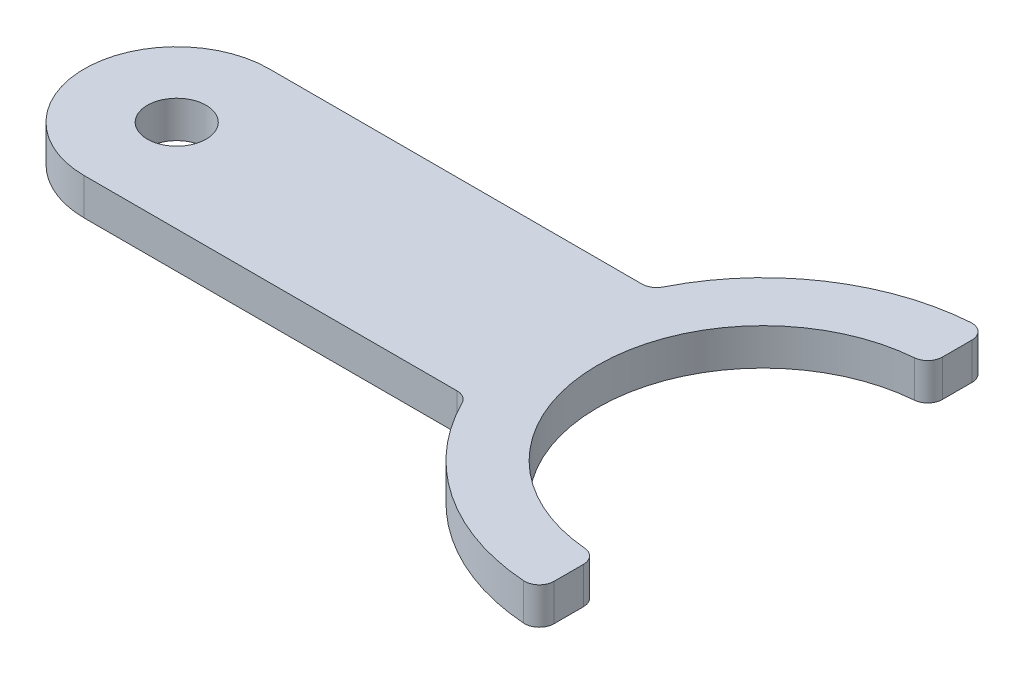
from build123d import *

# Parameters (mm, degrees)
SKETCH1_R           = 4
BOSS_EXTRUDE1_DEPTH = 5


with BuildPart() as part:
    # Sketch1 → Boss-Extrude1 (new body)
    with BuildSketch(Plane(origin=(0, 0, 0), x_dir=(1, 0, 0), z_dir=(0, 1, 0))):
        with BuildLine():
            Line((0, 12.580465515), (50.714293016, 12.580465515))
            ThreePointArc((50.714293016, 12.580465515), (51.764359173, 12.878301873), (52.501677451, 13.68310445))
            ThreePointArc((52.501677451, 13.68310445), (62.84292145, 25.376627415), (77.615630991, 30.421115454))
            ThreePointArc((77.615630991, 30.421115454), (79.119682878, 29.889047403), (79.756, 28.4260474))
            Line((79.756, 28.4260474), (79.756, 24.418230894))
            ThreePointArc((79.756, 24.418230894), (79.226804306, 23.06296904), (77.919265306, 22.424905923))
            ThreePointArc((77.919265306, 22.424905923), (57.256, 0), (77.919265306, -22.424905923))
            ThreePointArc((77.919265306, -22.424905923), (79.226804306, -23.06296904), (79.756, -24.418230894))
            Line((79.756, -24.418230894), (79.756, -28.4260474))
            ThreePointArc((79.756, -28.4260474), (79.119682878, -29.889047403), (77.615630991, -30.421115454))
            ThreePointArc((77.615630991, -30.421115454), (62.84292145, -25.376627415), (52.501677451, -13.68310445))
            ThreePointArc((52.501677451, -13.68310445), (51.764359173, -12.878301873), (50.714293016, -12.580465515))
            Line((50.714293016, -12.580465515), (0, -12.580465515))
            ThreePointArc((0, -12.580465515), (-12.580465515, 0), (0, 12.580465515))
        make_face()
        with Locations(Location((0, 0, 0), (0, 0, 270))):
            Circle(SKETCH1_R, mode=Mode.SUBTRACT)
    extrude(amount=BOSS_EXTRUDE1_DEPTH)


solid = part.part
